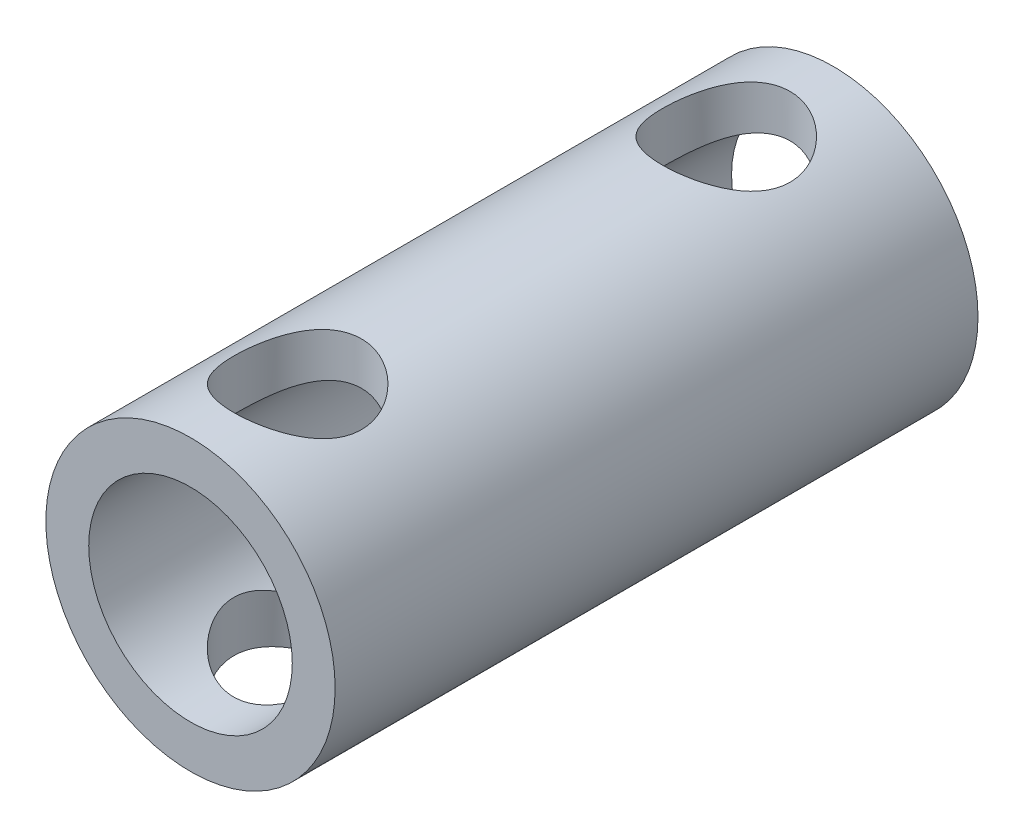
from build123d import *

# Parameters (mm, degrees)
SKETCH1_R           = 3.375
SKETCH1_R_2         = 2.3749
BOSS_EXTRUDE1_DEPTH = 7.5
SKETCH2_R           = 1.49
CUT_EXTRUDE1_DEPTH  = 12.5


with BuildPart() as part:
    # Sketch1 → Boss-Extrude1 (new, symmetric)
    with BuildSketch(Plane.XY):
        Circle(SKETCH1_R)
        Circle(SKETCH1_R_2, mode=Mode.SUBTRACT)
    extrude(amount=BOSS_EXTRUDE1_DEPTH, both=True)

    # Sketch2 → Cut-Extrude1 (cut, symmetric)
    with BuildSketch(Plane(origin=(0, 0, 0), x_dir=(1, 0, 0), z_dir=(0, 1, 0))):
        with Locations(Location((0, -5, 0), (0, 0, 270))):
            Circle(SKETCH2_R)
    cut_extrude1 = extrude(amount=CUT_EXTRUDE1_DEPTH, both=True, mode=Mode.SUBTRACT)

    # Mirror1: Cut-Extrude1 across plane
    add(cut_extrude1.mirror(Plane.XY), mode=Mode.SUBTRACT)


solid = part.part
